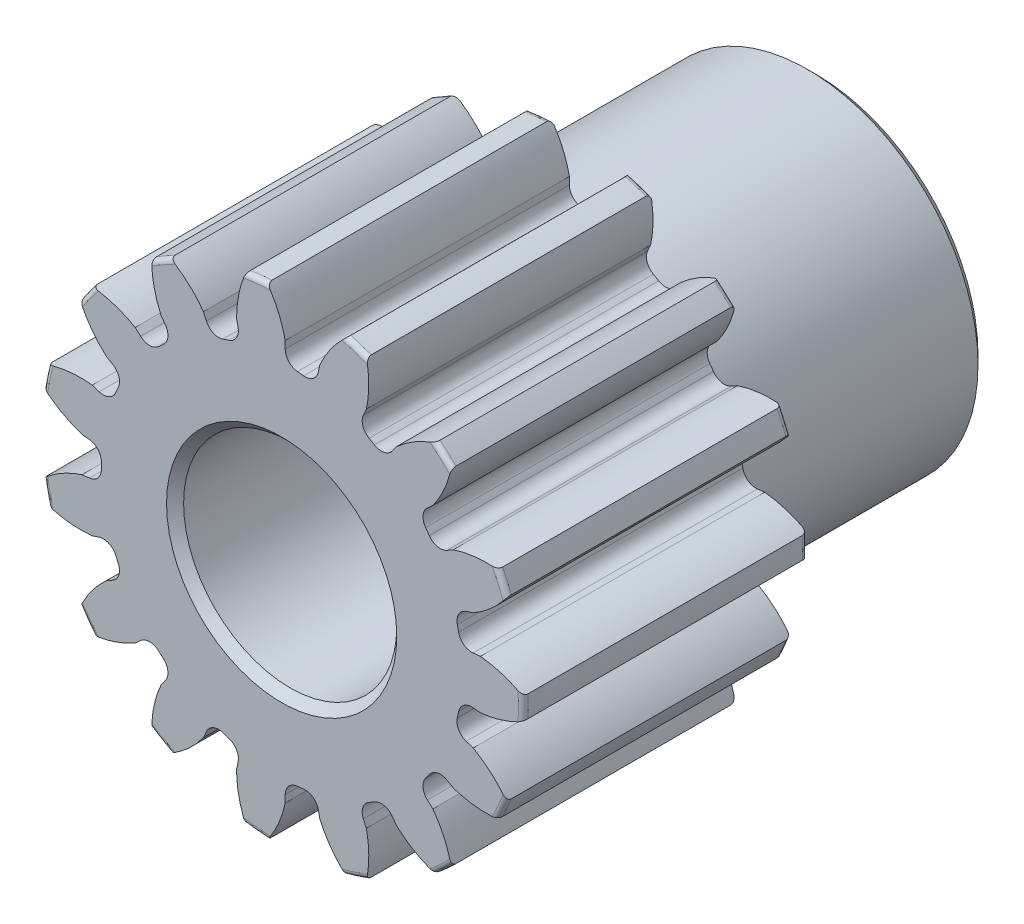
from build123d import *

# Parameters (mm, degrees)
SKETCH1_R                = 10.795
BOSS_EXTRUDE1_DEPTH      = 12.7
SKETCH2_W                = 11.176
SKETCH2_H                = 7.62
FILLET2_R                = 0.2159
CUT_EXTRUDE1_DEPTH       = 29.339503001
FILLET1_R                = 0.5984748
CIRPATTERN1_COUNT        = 15
FILLET1_OF_CIRPATTERN1_R = 0.5984748
SKETCH5_R                = 4.7625
CUT_EXTRUDE2_DEPTH       = 29.332093844
CHAMFER1_SIZE            = 0.381


with BuildPart() as part:
    # Sketch1 → Boss-Extrude1 (new body)
    with BuildSketch(Plane.XY):
        Circle(SKETCH1_R)
    extrude(amount=-BOSS_EXTRUDE1_DEPTH)

    # Sketch2 → Revolve1 (revolve)
    with BuildSketch(Plane(origin=(0, 0, 0), x_dir=(0, 0, -1), z_dir=(1, 0, 0)), mode=Mode.PRIVATE) as revolve1_sk:
        with Locations((18.288, 3.81)):
            Rectangle(SKETCH2_W, SKETCH2_H)
    revolve(revolve1_sk.sketch.rotate(Axis((0, 0, -12.7), (0, 0, -1)), 90), axis=Axis((0, 0, -12.7), (0, 0, -1)))

    # Fillet2
    fillet2_edges = [part.edges().sort_by_distance(p)[0] for p in [
        (-10.795, 0, 0),
        (-10.795, 0, -12.7),
        (-7.62, 0, -12.7),
    ]]
    fillet(fillet2_edges, radius=FILLET2_R)

    # Sketch4 → Cut-Extrude1 (cut, through all)
    with BuildSketch(Plane.XY):
        with BuildLine():
            Line((0.158117624, 8.949175479), (0.158117624, 8.054058063))
            ThreePointArc((0.158117624, 8.054058063), (0.842042496, 8.011480319), (1.51987433, 7.910931329))
            Line((1.51987433, 7.910931329), (1.705980134, 8.786488191))
            add(Edge.make_bspline(
                [(5.043237888, 11.616299545), (2.6061384, 10.812637333), (1.705980134, 8.786488191)],
                knots=[0, 0, 0, 1, 1, 1], degree=2))
            ThreePointArc((5.043237888, 11.616299545), (1.323734075, 12.594458766), (-2.517860482, 12.411004879))
            add(Edge.make_bspline(
                [(-2.517860482, 12.411004879), (-0.301108868, 11.118202053), (0.158117624, 8.949175479)],
                knots=[0, 0, 0, 1, 1, 1], degree=2))
        make_face()
    cut_extrude1 = extrude(amount=-CUT_EXTRUDE1_DEPTH, mode=Mode.SUBTRACT)

    # Fillet1
    fillet1_edges = [part.edges().sort_by_distance(p)[0] for p in [
        (1.51987433, 7.910931329, -6.35),
        (0.158117624, 8.054058063, -6.35),
    ]]
    fillet(fillet1_edges, radius=FILLET1_R)

    # CirPattern1: Cut-Extrude1 ×15 about axis
    cirpattern1_axis = Axis((0, 0, -12.7), (0, 0, 1))
    for i in range(1, CIRPATTERN1_COUNT):
        add(cut_extrude1.rotate(cirpattern1_axis, i * 360 / CIRPATTERN1_COUNT), mode=Mode.SUBTRACT)

    # Fillet1 of CirPattern1
    fillet1_of_cirpattern1_edges = [part.edges().sort_by_distance(p)[0] for p in [
        (-1.829191362, 7.845183964, -6.35),
        (-3.131432903, 7.422060391, -6.35),
        (-4.86197325, 6.422933021, -6.35),
        (-5.879530232, 5.50672105, -6.35),
        (-7.054075793, 3.890098607, -6.35),
        (-7.611003371, 2.639219612, -6.35),
        (-8.026464548, 0.684630804, -6.35),
        (-8.026464883, -0.684626873, -6.35),
        (-7.611004663, -2.639215884, -6.35),
        (-7.054077699, -3.890095152, -6.35),
        (-5.879532929, -5.50671817, -6.35),
        (-4.861976396, -6.422930639, -6.35),
        (-3.131436538, -7.422058857, -6.35),
        (-1.829195205, -7.845183068, -6.35),
        (0.15811368, -8.054058141, -6.35),
        (1.519870455, -7.910932073, -6.35),
        (3.420324605, -7.293437603, -6.35),
        (4.606136706, -6.608809055, -6.35),
        (6.091130334, -5.271715445, -6.35),
        (6.895960074, -4.163962911, -6.35),
        (7.708724292, -2.338465794, -6.35),
        (7.993409298, -0.999129752, -6.35),
        (7.993409788, 0.999125837, -6.35),
        (7.708725437, 2.338462019, -6.35),
        (6.895962114, 4.163959534, -6.35),
        (6.091132916, 5.271712461, -6.35),
        (4.606139942, 6.608806799, -6.35),
        (3.420328177, 7.293435928, -6.35),
    ]]
    fillet(fillet1_of_cirpattern1_edges, radius=FILLET1_OF_CIRPATTERN1_R)

    # Sketch5 → Cut-Extrude2 (cut, through all)
    with BuildSketch(Plane.XY):
        Circle(SKETCH5_R)
    extrude(amount=-CUT_EXTRUDE2_DEPTH, mode=Mode.SUBTRACT)

    # Chamfer1
    chamfer1_edges = [part.edges().sort_by_distance(p)[0] for p in [
        (-7.62, 0, -23.876),
        (-4.7625, 0, -23.876),
        (-4.7625, 0, 0),
    ]]
    chamfer(chamfer1_edges, length=CHAMFER1_SIZE)


solid = part.part
